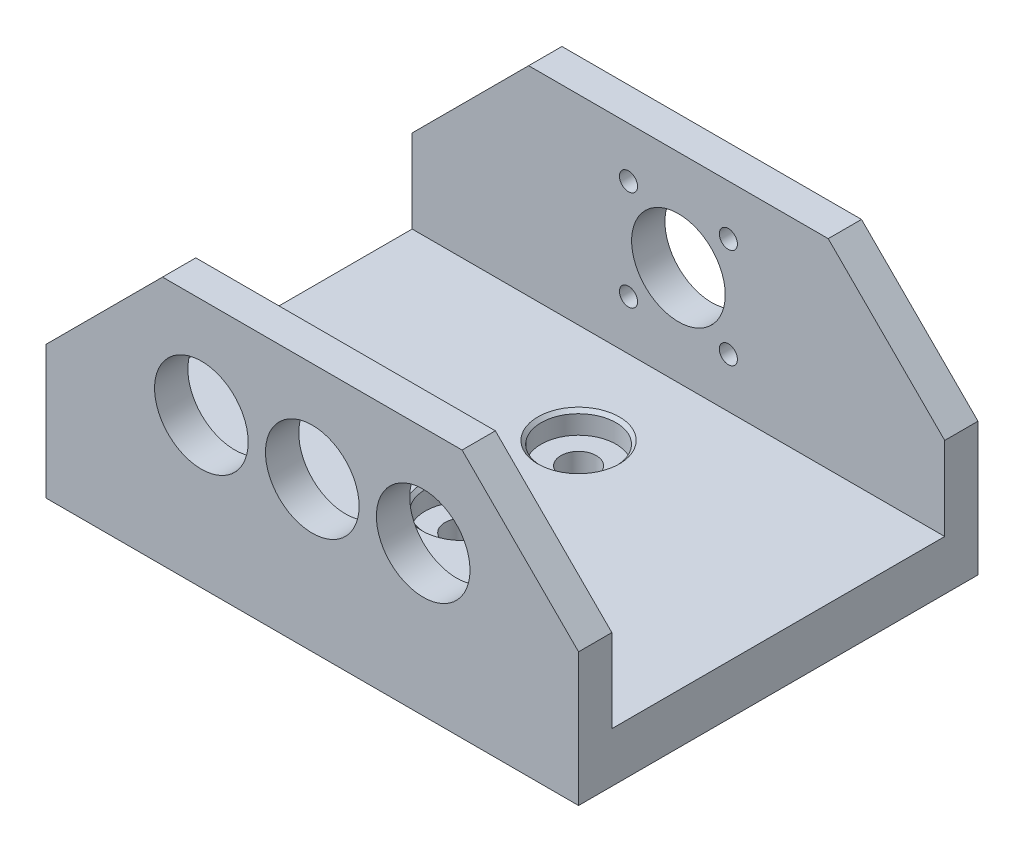
from build123d import *

# Parameters (mm, degrees)
SKETCH1_W                                    = 101.6
SKETCH1_H                                    = 76.2
BOSS_EXTRUDE1_DEPTH                          = 50.8
CUT_EXTRUDE1_DEPTH                           = 31.75
CUT_EXTRUDE1_DEPTH_BACK                      = 31.75
SKETCH9_W                                    = 101.6
SKETCH9_H                                    = 41.275
F_45_64_0_70313_DIAMETER_HOLE1_D             = 17.859502
F_45_64_0_70313_DIAMETER_HOLE2_D             = 17.859502
F_45_64_0_70313_DIAMETER_HOLE2_DEPTH         = 25.4
F_45_64_0_70313_DIAMETER_HOLE2_TIP           = 5.365535714
CBORE_FOR_1_4_BINDING_HEAD_MACHINE_S_2_COUNT = 2
CBORE_FOR_1_4_BINDING_HEAD_MACHINE_S_2_PITCH = 22.098
CUT_EXTRUDE3_DEPTH                           = 137.783186101
F_8_32_TAPPED_HOLE1_D                        = 3.4544
F_8_32_TAPPED_HOLE1_DEPTH                    = 6.35


with BuildPart() as part:
    # Sketch1 → Boss-Extrude1 (new body)
    with BuildSketch(Plane(origin=(0, 0, 0), x_dir=(1, 0, 0), z_dir=(0, 1, 0))):
        with Locations((50.8, 38.1)):
            Rectangle(SKETCH1_W, SKETCH1_H)
    extrude(amount=BOSS_EXTRUDE1_DEPTH)

    # Sketch9 → Cut-Extrude1 (cut, two sides: drawn at the far end of the back side and taken through both)
    with BuildSketch(Plane.XY.offset(-38.1).offset(-CUT_EXTRUDE1_DEPTH_BACK)):
        with Locations((50.8, 30.1625)):
            Rectangle(SKETCH9_W, SKETCH9_H)
    extrude(amount=CUT_EXTRUDE1_DEPTH + CUT_EXTRUDE1_DEPTH_BACK, mode=Mode.SUBTRACT)

    # 45/64 (0.70313) Diameter Hole1 (through all)
    with Locations(Plane.XY):
        with Locations((50.8, 28.5242)):
            Hole(F_45_64_0_70313_DIAMETER_HOLE1_D / 2)

    # 45/64 (0.70313) Diameter Hole2
    with Locations(Plane.XY):
        with Locations((29.6418, 28.5242), (71.9582, 28.5242)):
            Hole(F_45_64_0_70313_DIAMETER_HOLE2_D / 2, depth=F_45_64_0_70313_DIAMETER_HOLE2_DEPTH)
            with Locations((0, 0, -(F_45_64_0_70313_DIAMETER_HOLE2_DEPTH + F_45_64_0_70313_DIAMETER_HOLE2_TIP / 2))):  # 118° drill point
                Cone(0, F_45_64_0_70313_DIAMETER_HOLE2_D / 2, F_45_64_0_70313_DIAMETER_HOLE2_TIP, mode=Mode.SUBTRACT)

    # Sketch14 → CBORE for 1/4 Binding Head Machine Screw1 (revolve, cut)
    with BuildSketch(Plane(origin=(50.8, 9.525, -50.8), x_dir=(0, 0, 1), z_dir=(1, 0, 0))):
        Polygon((0, 0), (0, 9.525), (3.3782, 9.525), (3.3782, 4.191), (7.14375, 4.191), (7.14375, 0.635), (7.77875, 0), align=None)
    cbore_for_1_4_binding_head_machine_screw = revolve(axis=Axis((50.8, 15.875, -50.8), (0, -1, 0)), mode=Mode.SUBTRACT)

    # CBORE for 1_4 Binding Head Machine S 2: CBORE for 1/4 Binding Head Machine Screw1 ×2
    with Locations(*[(0, 0, i * CBORE_FOR_1_4_BINDING_HEAD_MACHINE_S_2_PITCH) for i in range(1, CBORE_FOR_1_4_BINDING_HEAD_MACHINE_S_2_COUNT)]):
        add(cbore_for_1_4_binding_head_machine_screw, mode=Mode.SUBTRACT)

    # Sketch17 → Cut-Extrude3 (cut, through all)
    with BuildSketch(Plane.XY):
        Polygon((0, 25.4), (22.225, 47.625), (79.375, 47.625), (101.6, 25.4), (101.6, 50.8), (0, 50.8), align=None)
    extrude(amount=-CUT_EXTRUDE3_DEPTH, mode=Mode.SUBTRACT)

    # #8-32 Tapped Hole1
    with Locations(Plane(origin=(0, 0, -76.2), x_dir=(-1, 0, 0), z_dir=(0, 0, -1))):
        with Locations((-41.275, 38.0492), (-60.325, 18.9992), (-60.325, 38.0492), (-41.275, 18.9992)):
            Hole(F_8_32_TAPPED_HOLE1_D / 2, depth=F_8_32_TAPPED_HOLE1_DEPTH)


solid = part.part
